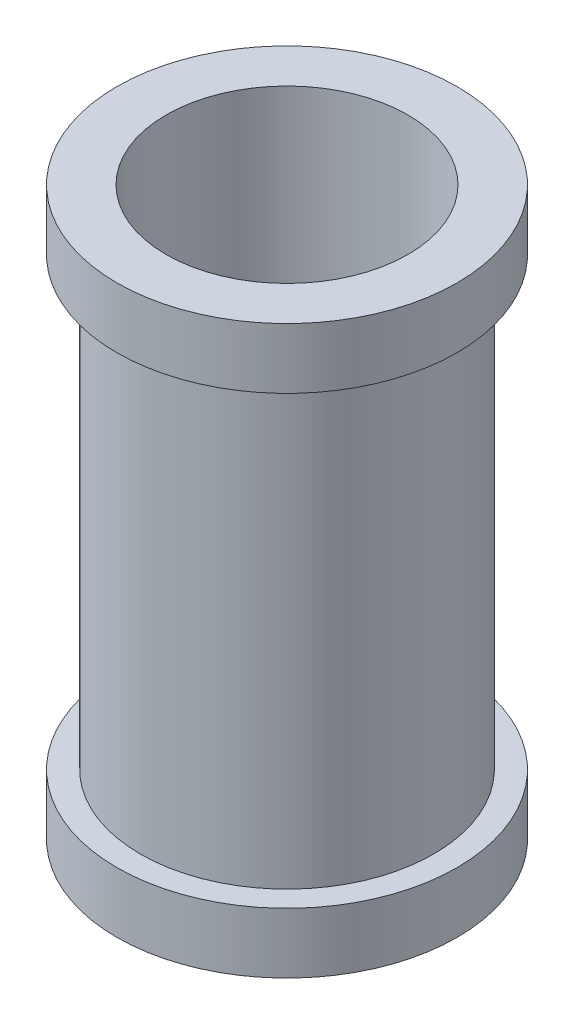
from build123d import *

# Parameters (mm, degrees)
SKETCH3_R           = 28.575
BOSS_EXTRUDE2_DEPTH = 10.16
SKETCH4_R           = 24.638
BOSS_EXTRUDE3_DEPTH = 85.09
BOSS_EXTRUDE4_START = -10.16
SKETCH5_R           = 28.575
BOSS_EXTRUDE4_DEPTH = 10.16
SKETCH6_R           = 20.32
CUT_EXTRUDE1_DEPTH  = 104.14


with BuildPart() as part:
    # Sketch3 → Boss-Extrude2 (new body)
    with BuildSketch(Plane(origin=(0, 0, 0), x_dir=(1, 0, 0), z_dir=(0, 1, 0))):
        with Locations(Location((0, 0, 0), (0, 0, 270))):
            Circle(SKETCH3_R)
    extrude(amount=BOSS_EXTRUDE2_DEPTH)

    # Sketch4 → Boss-Extrude3 (add)
    with BuildSketch(Plane(origin=(0, 10.16, 0), x_dir=(1, 0, 0), z_dir=(0, 1, 0))):
        with Locations(Location((0, 0, 0), (0, 0, 270))):
            Circle(SKETCH4_R)
    extrude(amount=BOSS_EXTRUDE3_DEPTH)

    # Sketch5 → Boss-Extrude4 (add)
    with BuildSketch(Plane(origin=(0, 95.25, 0), x_dir=(1, 0, 0), z_dir=(0, 1, 0)).offset(BOSS_EXTRUDE4_START)):
        with Locations(Location((0, 0, 0), (0, 0, 270))):
            Circle(SKETCH5_R)
    extrude(amount=BOSS_EXTRUDE4_DEPTH)

    # Sketch6 → Cut-Extrude1 (cut)
    with BuildSketch(Plane(origin=(0, 95.25, 0), x_dir=(1, 0, 0), z_dir=(0, 1, 0))):
        with Locations(Location((0, 0, 0), (0, 0, 270))):
            Circle(SKETCH6_R)
    extrude(amount=-CUT_EXTRUDE1_DEPTH, mode=Mode.SUBTRACT)


solid = part.part
